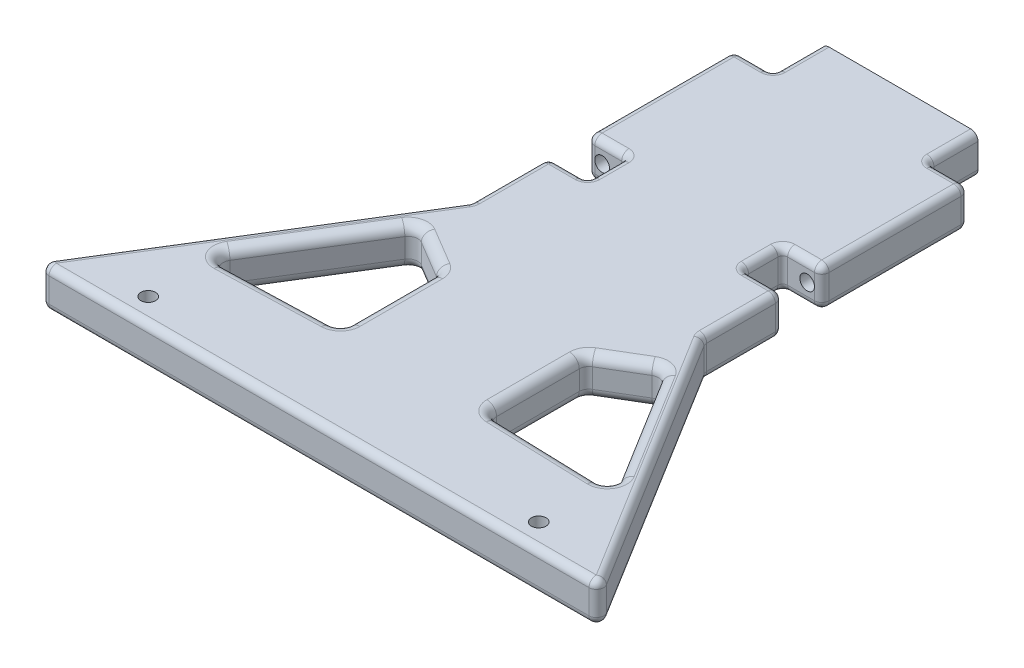
from build123d import *

# Parameters (mm, degrees)
BOSS_EXTRUDE1_DEPTH = 8
FILLET1_R           = 1
FILLET2_R           = 1.5
FILLET3_R           = 2
SKETCH2_R           = 1.5
CUT_EXTRUDE1_DEPTH  = 47
SKETCH3_R           = 1.5
CUT_EXTRUDE2_DEPTH  = 166.548074645


with BuildPart() as part:
    # Sketch1 → Boss-Extrude1 (new body)
    with BuildSketch(Plane(origin=(0, 0, 0), x_dir=(1, 0, 0), z_dir=(0, 1, 0))):
        Polygon((58, 119), (58, 0), (116, 0), (82, 55), (82, 71), (74, 71), (74, 79), (82, 79), (82, 109), (74, 109), (74, 119), align=None)
        Polygon((99.987021547, 18.613409802), (73, 19.450468943), (73, 39.450468943), (83.307933748, 45.594287125), align=None, mode=Mode.SUBTRACT)
    extrude(amount=BOSS_EXTRUDE1_DEPTH)

    # Fillet1
    fillet1_edges = [part.edges().sort_by_distance(p)[0] for p in [
        (74, 4, -109),
        (74, 4, -79),
        (74, 4, -71),
    ]]
    fillet(fillet1_edges, radius=FILLET1_R)

    # Fillet2
    fillet2_edges = [part.edges().sort_by_distance(p)[0] for p in [
        (74, 0, -114.5),
        (82, 0, -94),
        (82, 0, -63),
        (99, 0, -27.5),
        (87, 0, 0),
        (82, 4, -109),
        (82, 4, -79),
        (82, 4, -71),
        (82, 4, -55),
        (116, 4, 0),
        (87, 8, 0),
        (99, 8, -27.5),
        (74, 0, -75),
        (82, 8, -63),
        (74, 8, -75),
        (78.5, 0, -71),
        (78.5, 8, -71),
        (78.5, 0, -79),
        (78.5, 8, -79),
        (78.5, 0, -109),
        (78.5, 8, -109),
        (74.292893219, 0, -71.292893219),
        (74.292893219, 8, -71.292893219),
        (74.292893219, 0, -78.707106781),
        (74.292893219, 8, -78.707106781),
        (74.292893219, 0, -109.292893219),
        (74.292893219, 8, -109.292893219),
        (82, 8, -94),
        (74, 8, -114.5),
    ]]
    fillet(fillet2_edges, radius=FILLET2_R)

    # Fillet3
    fillet3_edges = [part.edges().sort_by_distance(p)[0] for p in [
        (86.493510774, 8, -19.031939373),
        (73, 8, -29.450468943),
        (78.153966874, 8, -42.522378034),
        (78.153966874, 0, -42.522378034),
        (73, 0, -29.450468943),
        (86.493510774, 0, -19.031939373),
        (91.647477648, 0, -32.103848464),
        (83.307933748, 4, -45.594287125),
        (73, 4, -39.450468943),
        (73, 4, -19.450468943),
        (99.987021547, 4, -18.613409802),
        (91.647477648, 8, -32.103848464),
    ]]
    fillet(fillet3_edges, radius=FILLET3_R)

    # Sketch2 → Cut-Extrude1 (cut)
    with BuildSketch(Plane(origin=(0, 0, -109), x_dir=(-1, 0, 0), z_dir=(0, 0, -1))):
        with Locations(Location((-79, 4, 0), (0, 0, 180))):
            Circle(SKETCH2_R)
    extrude(amount=-CUT_EXTRUDE1_DEPTH, mode=Mode.SUBTRACT)

    # Sketch3 → Cut-Extrude2 (cut, through all)
    with BuildSketch(Plane(origin=(0, 8, 0), x_dir=(1, 0, 0), z_dir=(0, 1, 0))):
        with Locations(Location((98, 5, 0), (0, 0, 270))):
            Circle(SKETCH3_R)
    extrude(amount=-CUT_EXTRUDE2_DEPTH, mode=Mode.SUBTRACT)

    # Mirror1: part across plane


with BuildPart() as part_1:
    add(part.part)
    add(part.part.mirror(Plane(origin=(58, 8, 0), x_dir=(0, 0, 1), z_dir=(1, 0, 0))))


solid = part_1.part
